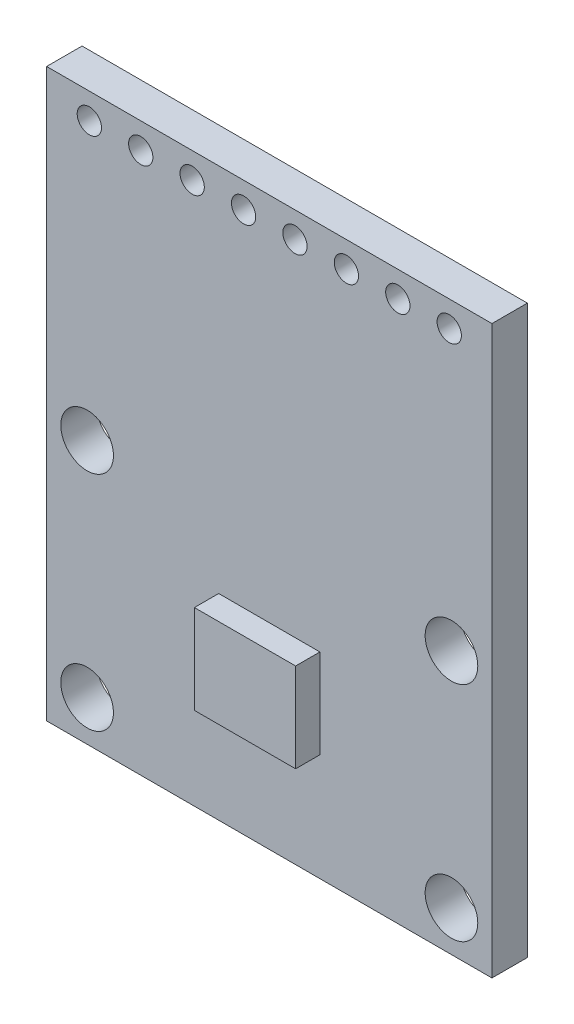
from build123d import *

# Parameters (mm, degrees)
SKETCH1_W               = 22
SKETCH1_H               = 28
BOSS_EXTRUDE1_DEPTH     = 1.75
SKETCH2_R               = 1.3
SKETCH2_R_2             = 1
CUT_EXTRUDE1_DEPTH      = 18.890290663
SKETCH3_R               = 0.6
CUT_EXTRUDE2_DEPTH      = 18.890290663
LPATTERN1_COUNT         = 4
LPATTERN1_PITCH         = 2.54
MIRROR1_COPY_1_SKETCH_R = 0.6
MIRROR1_COPY_1_DEPTH    = 18.890290663
MIRROR1_COPY_2_SKETCH_R = 0.6
MIRROR1_COPY_2_DEPTH    = 18.890290663
MIRROR1_COPY_3_SKETCH_R = 0.6
MIRROR1_COPY_3_DEPTH    = 18.890290663
SKETCH4_W               = 5
SKETCH4_H               = 4.4
BOSS_EXTRUDE2_DEPTH     = 1.2


with BuildPart() as part:
    # Sketch1 → Boss-Extrude1 (new body)
    with BuildSketch(Plane.XY):
        Rectangle(SKETCH1_W, SKETCH1_H)
    extrude(amount=BOSS_EXTRUDE1_DEPTH)

    # Sketch2 → Cut-Extrude1 (cut, through all)
    with BuildSketch(Plane.XY.offset(1.75)):
        with Locations((-9, -1)):
            Circle(SKETCH2_R)
        with Locations((-9, -12)):
            Circle(SKETCH2_R)
        with Locations((9, -12)):
            Circle(SKETCH2_R)
        with Locations((9, -1)):
            Circle(SKETCH2_R)
        with Locations((0, -6.5)):
            Circle(SKETCH2_R_2)
    extrude(amount=-CUT_EXTRUDE1_DEPTH, mode=Mode.SUBTRACT)

    # Sketch3 → Cut-Extrude2 (cut, through all)
    with BuildSketch(Plane.XY.offset(1.75)):
        with Locations((-1.27, 12.73)):
            Circle(SKETCH3_R)
    cut_extrude2 = extrude(amount=-CUT_EXTRUDE2_DEPTH, mode=Mode.SUBTRACT)

    # LPattern1: Cut-Extrude2 ×4
    with Locations(*[(-i * LPATTERN1_PITCH, 0, 0) for i in range(1, LPATTERN1_COUNT)]):
        add(cut_extrude2, mode=Mode.SUBTRACT)

    # Mirror1: Cut-Extrude2 across plane
    add(cut_extrude2.mirror(Plane(origin=(0, 0, 0), x_dir=(0, 0, 1), z_dir=(1, 0, 0))), mode=Mode.SUBTRACT)

    # Mirror1 copy 1 sketch → Mirror1 copy 1 (cut, through all)
    with BuildSketch(Plane(origin=(2.54, 0, 1.75), x_dir=(-1, 0, 0), z_dir=(0, 0, 1))):
        with Locations((-1.27, -12.73)):
            Circle(MIRROR1_COPY_1_SKETCH_R)
    extrude(amount=-MIRROR1_COPY_1_DEPTH, mode=Mode.SUBTRACT)

    # Mirror1 copy 2 sketch → Mirror1 copy 2 (cut, through all)
    with BuildSketch(Plane(origin=(5.08, 0, 1.75), x_dir=(-1, 0, 0), z_dir=(0, 0, 1))):
        with Locations((-1.27, -12.73)):
            Circle(MIRROR1_COPY_2_SKETCH_R)
    extrude(amount=-MIRROR1_COPY_2_DEPTH, mode=Mode.SUBTRACT)

    # Mirror1 copy 3 sketch → Mirror1 copy 3 (cut, through all)
    with BuildSketch(Plane(origin=(7.62, 0, 1.75), x_dir=(-1, 0, 0), z_dir=(0, 0, 1))):
        with Locations((-1.27, -12.73)):
            Circle(MIRROR1_COPY_3_SKETCH_R)
    extrude(amount=-MIRROR1_COPY_3_DEPTH, mode=Mode.SUBTRACT)

    # Sketch4 → Boss-Extrude2 (add)
    with BuildSketch(Plane.XY.offset(1.75)):
        with Locations((0, -6.5)):
            Rectangle(SKETCH4_W, SKETCH4_H)
    extrude(amount=BOSS_EXTRUDE2_DEPTH)


solid = part.part
